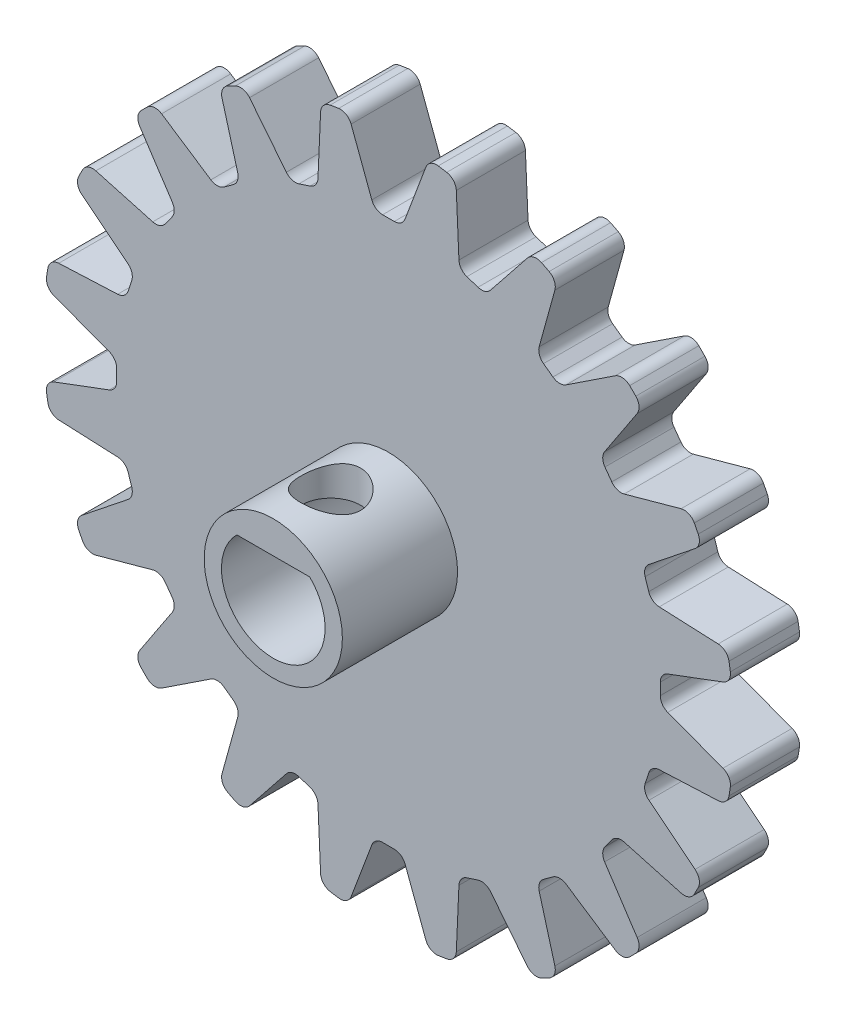
from build123d import *

# Parameters (mm, degrees)
SKETCH1_R                      = 15
BOSS_EXTRUDE1_DEPTH            = 3
CUT_EXTRUDE1_DEPTH             = 5
CIRPATTERN1_COUNT              = 20
FILLET1_R                      = 0.5
SKETCH3_R                      = 3
BOSS_EXTRUDE2_DEPTH            = 5
SKETCH11_R                     = 3.338819638
BOSS_EXTRUDE3_DEPTH            = 1.5
CUT_EXTRUDE2_REACH             = 24.471
CUT_EXTRUDE2_DIRECTION_2_DEPTH = 1.5
SKETCH10_R                     = 1.3
CUT_EXTRUDE3_DEPTH             = 3


with BuildPart() as part:
    # Sketch1 → Boss-Extrude1 (new body)
    with BuildSketch(Plane.XY):
        Circle(SKETCH1_R)
    extrude(amount=BOSS_EXTRUDE1_DEPTH)

    # Sketch2 → Cut-Extrude1 (cut)
    with BuildSketch(Plane.XY.offset(3)):
        Polygon((1.8, 15), (-1.8, 15), (-0.6, 11.8), (0.6, 11.8), align=None)
    cut_extrude1 = extrude(amount=-CUT_EXTRUDE1_DEPTH, mode=Mode.SUBTRACT)

    # CirPattern1: Cut-Extrude1 ×20 about axis
    cirpattern1_axis = Axis((0, 0, 3), (0, 0, 1))
    for i in range(1, CIRPATTERN1_COUNT):
        add(cut_extrude1.rotate(cirpattern1_axis, i * 360 / CIRPATTERN1_COUNT), mode=Mode.SUBTRACT)

    # Fillet1
    fillet1_edges = [part.edges().sort_by_distance(p)[0] for p in [
        (9.193729382, 7.421276174, 1.5),
        (9.899071685, 6.45045578, 1.5),
        (13.086473758, 7.331043895, 1.5),
        (13.622975377, 6.278100181, 1.5),
        (11.037056696, 4.217034443, 1.5),
        (11.407877089, 3.075766624, 1.5),
        (14.711393293, 2.92829428, 1.5),
        (14.896259152, 1.761097182, 1.5),
        (11.8, 0.6, 1.5),
        (11.8, -0.6, 1.5),
        (14.896259152, -1.761097182, 1.5),
        (14.711393293, -2.92829428, 1.5),
        (11.407877089, -3.075766624, 1.5),
        (11.037056696, -4.217034443, 1.5),
        (13.622975377, -6.278100181, 1.5),
        (13.086473758, -7.331043895, 1.5),
        (9.899071685, -6.45045578, 1.5),
        (9.193729382, -7.421276174, 1.5),
        (11.016179855, -10.180558993, 1.5),
        (10.180558993, -11.016179855, 1.5),
        (7.421276174, -9.193729382, 1.5),
        (6.45045578, -9.899071685, 1.5),
        (7.331043895, -13.086473758, 1.5),
        (6.278100181, -13.622975377, 1.5),
        (4.217034443, -11.037056696, 1.5),
        (3.075766624, -11.407877089, 1.5),
        (2.92829428, -14.711393293, 1.5),
        (1.761097182, -14.896259152, 1.5),
        (0.6, -11.8, 1.5),
        (-0.6, -11.8, 1.5),
        (-1.761097182, -14.896259152, 1.5),
        (-2.92829428, -14.711393293, 1.5),
        (-3.075766624, -11.407877089, 1.5),
        (-4.217034443, -11.037056696, 1.5),
        (-6.278100181, -13.622975377, 1.5),
        (-7.331043895, -13.086473758, 1.5),
        (-6.45045578, -9.899071685, 1.5),
        (-7.421276174, -9.193729382, 1.5),
        (-10.180558993, -11.016179855, 1.5),
        (-11.016179855, -10.180558993, 1.5),
        (-9.193729382, -7.421276174, 1.5),
        (-9.899071685, -6.45045578, 1.5),
        (-13.086473758, -7.331043895, 1.5),
        (-13.622975377, -6.278100181, 1.5),
        (-11.037056696, -4.217034443, 1.5),
        (-11.407877089, -3.075766624, 1.5),
        (-14.711393293, -2.92829428, 1.5),
        (-14.896259152, -1.761097182, 1.5),
        (-11.8, -0.6, 1.5),
        (-11.8, 0.6, 1.5),
        (-14.896259152, 1.761097182, 1.5),
        (-14.711393293, 2.92829428, 1.5),
        (-11.407877089, 3.075766624, 1.5),
        (-11.037056696, 4.217034443, 1.5),
        (-13.622975377, 6.278100181, 1.5),
        (-13.086473758, 7.331043895, 1.5),
        (-9.899071685, 6.45045578, 1.5),
        (-9.193729382, 7.421276174, 1.5),
        (-11.016179855, 10.180558993, 1.5),
        (-10.180558993, 11.016179855, 1.5),
        (-7.421276174, 9.193729382, 1.5),
        (-6.45045578, 9.899071685, 1.5),
        (-7.331043895, 13.086473758, 1.5),
        (-4.217034443, 11.037056696, 1.5),
        (-3.075766624, 11.407877089, 1.5),
        (-2.92829428, 14.711393293, 1.5),
        (-1.761097182, 14.896259152, 1.5),
        (-0.6, 11.8, 1.5),
        (0.6, 11.8, 1.5),
        (1.761097182, 14.896259152, 1.5),
        (2.92829428, 14.711393293, 1.5),
        (3.075766624, 11.407877089, 1.5),
        (4.217034443, 11.037056696, 1.5),
        (6.278100181, 13.622975377, 1.5),
        (7.331043895, 13.086473758, 1.5),
        (6.45045578, 9.899071685, 1.5),
        (7.421276174, 9.193729382, 1.5),
        (10.180558993, 11.016179855, 1.5),
        (11.016179855, 10.180558993, 1.5),
        (-6.278100181, 13.622975377, 1.5),
    ]]
    fillet(fillet1_edges, radius=FILLET1_R)

    # Sketch3 → Boss-Extrude2 (add)
    with BuildSketch(Plane.XY.offset(3)):
        Circle(SKETCH3_R)
    extrude(amount=BOSS_EXTRUDE2_DEPTH)

    # Sketch11 → Boss-Extrude3 (add)
    with BuildSketch(Plane(origin=(0, 0, 0), x_dir=(-1, 0, 0), z_dir=(0, 0, -1))):
        Circle(SKETCH11_R)
    extrude(amount=BOSS_EXTRUDE3_DEPTH)

    # Sketch4 → Cut-Extrude2 (cut, up to next)
    with BuildSketch(Plane(origin=(0, 0, 0), x_dir=(-1, 0, 0), z_dir=(0, 0, -1)), mode=Mode.PRIVATE) as cut_extrude2_sk1:
        with BuildLine():
            Line((-1.581929202, 1.6), (1.581929202, 1.6))
            ThreePointArc((1.581929202, 1.6), (0, -2.25), (-1.581929202, 1.6))
        make_face()
    cut_extrude2_tool1 = extrude(cut_extrude2_sk1.sketch, amount=-CUT_EXTRUDE2_REACH, mode=Mode.PRIVATE) & part.part
    add(cut_extrude2_tool1.solids().sort_by_distance((0, -0.182163, 0))[0], mode=Mode.SUBTRACT)

    # Sketch4 → Cut-Extrude2 direction 2 (cut)
    with BuildSketch(Plane(origin=(0, 0, 0), x_dir=(-1, 0, 0), z_dir=(0, 0, -1))):
        with BuildLine():
            Line((-1.581929202, 1.6), (1.581929202, 1.6))
            ThreePointArc((1.581929202, 1.6), (0, -2.25), (-1.581929202, 1.6))
        make_face()
    extrude(amount=CUT_EXTRUDE2_DIRECTION_2_DEPTH, mode=Mode.SUBTRACT)

    # Sketch10 → Cut-Extrude3 (cut)
    with BuildSketch(Plane(origin=(0, 3, 0), x_dir=(1, 0, 0), z_dir=(0, 1, 0))):
        with Locations((-0.005793505, -5.5)):
            Circle(SKETCH10_R)
    extrude(amount=-CUT_EXTRUDE3_DEPTH, mode=Mode.SUBTRACT)


solid = part.part
